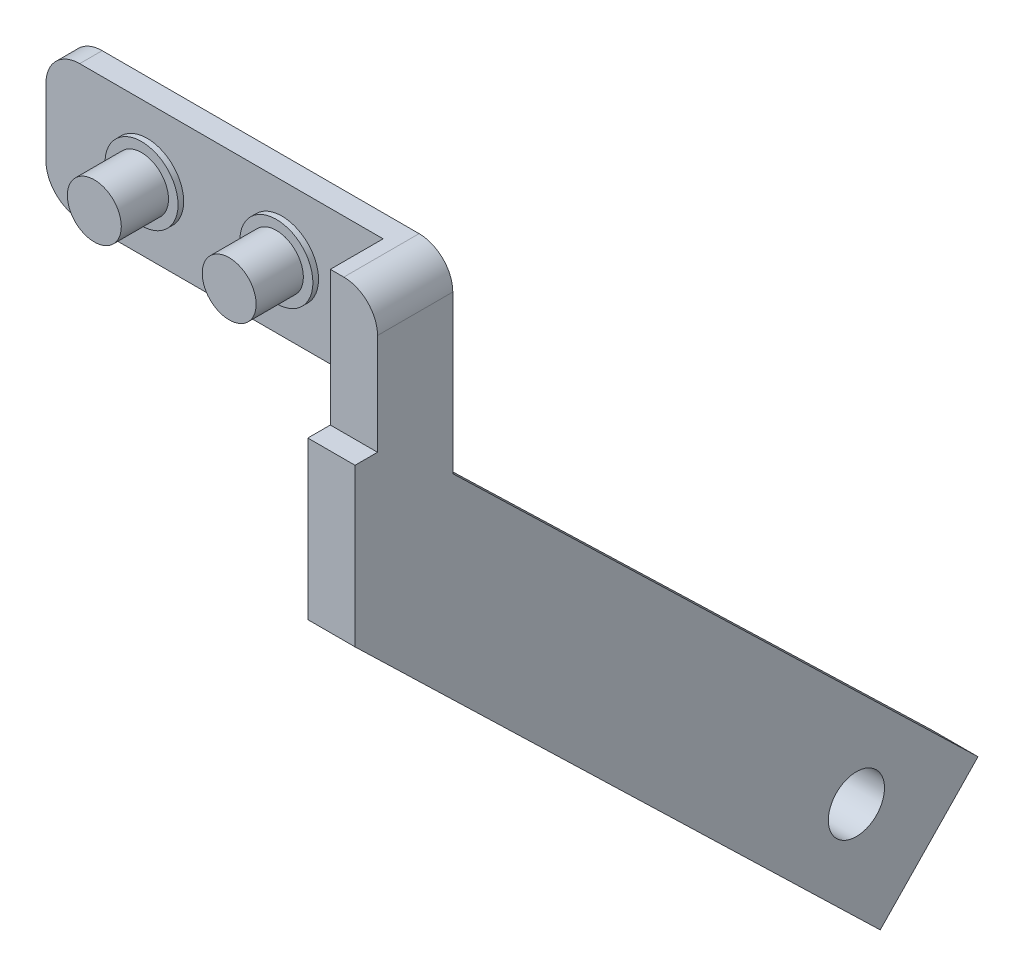
from build123d import *

# Parameters (mm, degrees)
ESQUISSE1_W             = 30
ESQUISSE1_H             = 12
BOSS_EXTRU_1_DEPTH      = 2
ESQUISSE2_R             = 3.25
BOSS_EXTRU_2_DEPTH      = 0.5
ESQUISSE3_R             = 2.4
BOSS_EXTRU_3_DEPTH      = 4.2
ESQUISSE6_W             = 6.7
ESQUISSE6_H             = 17
BOSS_EXTRU_4_DEPTH      = 4.2
ESQUISSE8_W             = 4.2
ESQUISSE8_H             = 5
BOSS_EXTRU_5_DEPTH      = 2
CONG_1_R                = 3
BOSS_EXTRU_6_START      = -4.2
BOSS_EXTRU_6_DEPTH      = 4.2
ESQUISSE12_W            = 4.2
ESQUISSE12_H            = 12.517587627
BOSS_EXTRU_8_DEPTH      = 65
ESQUISSE13_R            = 2.5
ENL_V_MAT_EXTRU_2_DEPTH = 4.2


with BuildPart() as part:
    # Esquisse1 → Boss.-Extru.1 (new body)
    with BuildSketch(Plane.XY):
        with Locations((2.190701098, -1.023529412)):
            Rectangle(ESQUISSE1_W, ESQUISSE1_H)
    extrude(amount=BOSS_EXTRU_1_DEPTH)

    # Esquisse2 → Boss.-Extru.2 (add)
    with BuildSketch(Plane.XY.offset(2)):
        with Locations((8.190701098, -1.023529412)):
            Circle(ESQUISSE2_R)
        with Locations((-3.809298902, -1.023529412)):
            Circle(ESQUISSE2_R)
    extrude(amount=BOSS_EXTRU_2_DEPTH)

    # Esquisse3 → Boss.-Extru.3 (add)
    with BuildSketch(Plane.XY.offset(2.5)):
        with Locations((-3.809298902, -1.023529412)):
            Circle(ESQUISSE3_R)
        with Locations((8.190701098, -1.023529412)):
            Circle(ESQUISSE3_R)
    extrude(amount=BOSS_EXTRU_3_DEPTH)

    # Esquisse6 → Boss.-Extru.4 (add)
    with BuildSketch(Plane(origin=(17.190701098, 0, 0), x_dir=(0, 0, -1), z_dir=(1, 0, 0))):
        with Locations((-3.35, -3.523529412)):
            Rectangle(ESQUISSE6_W, ESQUISSE6_H)
    extrude(amount=BOSS_EXTRU_4_DEPTH)

    # Esquisse8 → Boss.-Extru.5 (add)
    with BuildSketch(Plane.XY.offset(6.7)):
        with Locations((19.290701098, -9.523529412)):
            Rectangle(ESQUISSE8_W, ESQUISSE8_H)
    extrude(amount=BOSS_EXTRU_5_DEPTH)

    # Congé1
    cong_1_edges = [part.edges().sort_by_distance(p)[0] for p in [
        (21.390701098, 4.976470588, 3.35),
        (-12.809298902, 4.976470588, 1),
        (-12.809298902, -7.023529412, 1),
    ]]
    fillet(cong_1_edges, radius=CONG_1_R)

    # Esquisse9 → Boss.-Extru.6 (add)
    with BuildSketch(Plane(origin=(21.390701098, 0, 0), x_dir=(0, 0, -1), z_dir=(1, 0, 0)).offset(BOSS_EXTRU_6_START)):
        Polygon((-8.7, -12.023529412), (-8.7, -21.023529412), (0, -12.023529412), align=None)
    extrude(amount=BOSS_EXTRU_6_DEPTH)

    # Esquisse12 → Boss.-Extru.8 (add)
    with BuildSketch(Plane(origin=(0, -5.808034598, -6.008311653), x_dir=(1, 0, 0), z_dir=(0, -0.6950220968474751, -0.7189883760491119))):
        with Locations((19.290701098, 14.9035717)):
            Rectangle(ESQUISSE12_W, ESQUISSE12_H)
    extrude(amount=BOSS_EXTRU_8_DEPTH)

    # Esquisse13 → Enlèv. mat.-Extru.2 (cut)
    with BuildSketch(Plane.ZY.offset(-17.190701098)):
        with Locations(Location((-35.913349059, -55.444766835, 0), (0, 0, 270))):
            Circle(ESQUISSE13_R)
    extrude(amount=-ENL_V_MAT_EXTRU_2_DEPTH, mode=Mode.SUBTRACT)


solid = part.part
